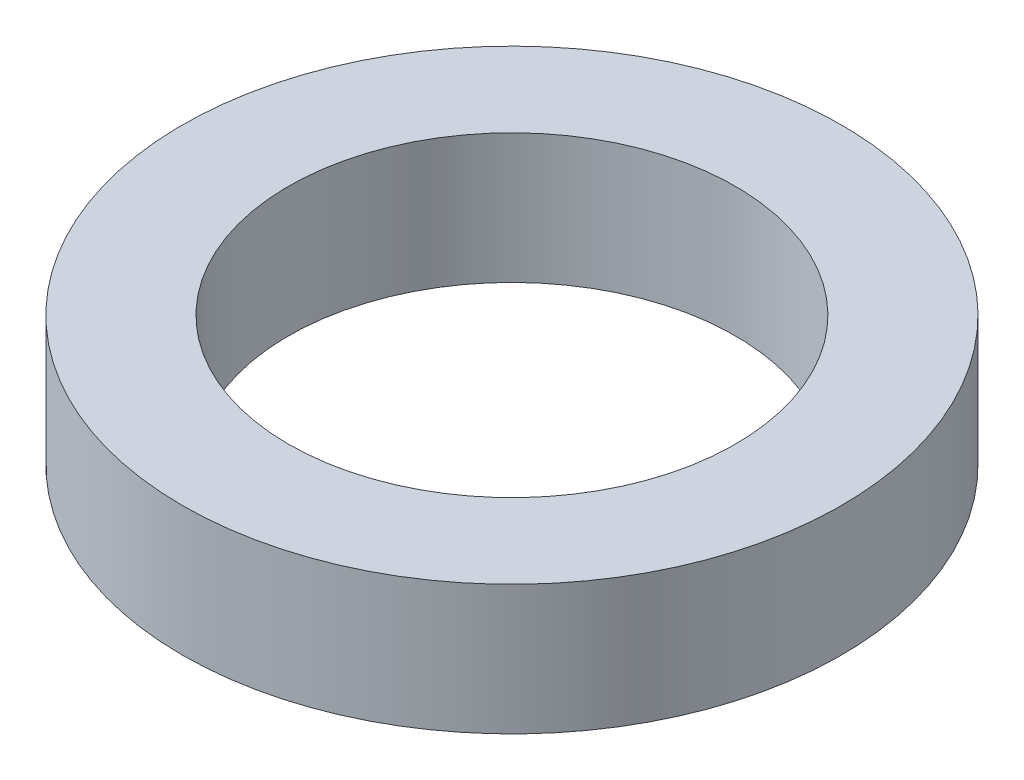
from build123d import *

# Parameters (mm, degrees)
SKETCH1_R           = 7.493
SKETCH1_R_2         = 5.08
BOSS_EXTRUDE1_DEPTH = 2.9464


with BuildPart() as part:
    # Sketch1 → Boss-Extrude1 (new body)
    with BuildSketch(Plane(origin=(0, 0, 0), x_dir=(1, 0, 0), z_dir=(0, 1, 0))):
        with Locations(Location((0, 0, 0), (0, 0, 270))):
            Circle(SKETCH1_R)
        with Locations(Location((0, 0, 0), (0, 0, 270))):
            Circle(SKETCH1_R_2, mode=Mode.SUBTRACT)
    extrude(amount=BOSS_EXTRUDE1_DEPTH)


solid = part.part
